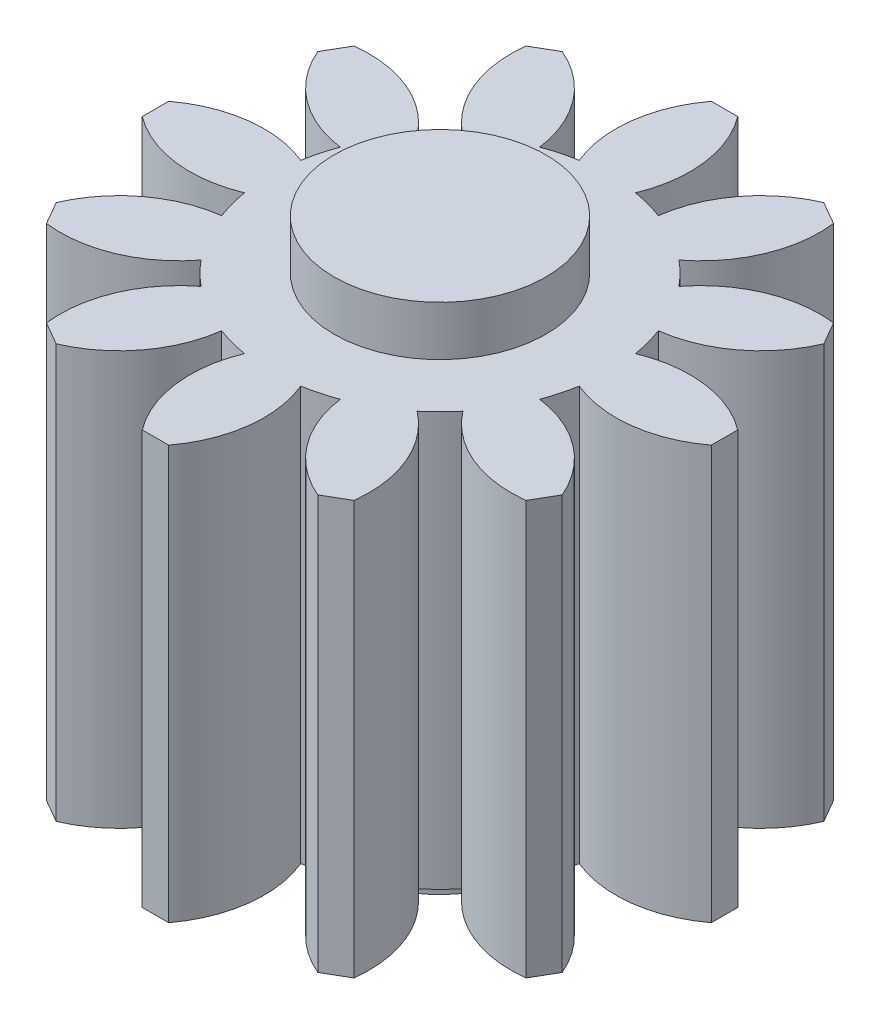
from build123d import *

# Parameters (mm, degrees)
BOSS_EXTRUDE2_DEPTH = 12.5
CIRPATTERN1_COUNT   = 12


with BuildPart() as part:
    # Sketch1 → Revolve1 (revolve)
    with BuildSketch(Plane(origin=(0, 0, 0), x_dir=(0, 0, -1), z_dir=(1, 0, 0)), mode=Mode.PRIVATE) as revolve1_sk:
        Polygon((0, 0), (3.2, 0), (3.2, 1.5), (5.13, 1.5), (5.13, 14), (3.2, 14), (3.2, 15.5), (0, 15.5), align=None)
    revolve(revolve1_sk.sketch.rotate(Axis((0, 15.5, 0), (0, -1, 0)), 180), axis=Axis((0, 15.5, 0), (0, -1, 0)))

    # Sketch2 → Boss-Extrude2 (add)
    with BuildSketch(Plane(origin=(0, 14, 0), x_dir=(1, 0, 0), z_dir=(0, 1, 0))):
        with BuildLine():
            Line((0.4, 8.6), (-0.4, 8.6))
            ThreePointArc((-0.4, 8.6), (-1.094743674, 6.889243261), (-0.85, 5.059090827))
            Line((-0.85, 5.059090827), (-0.85, 4.768997596))
            Line((-0.85, 4.768997596), (0.85, 4.768997596))
            Line((0.85, 4.768997596), (0.85, 5.059090827))
            ThreePointArc((0.85, 5.059090827), (1.094743674, 6.889243261), (0.4, 8.6))
        make_face()
    boss_extrude2 = extrude(amount=-BOSS_EXTRUDE2_DEPTH)

    # CirPattern1: Boss-Extrude2 ×12 about axis
    cirpattern1_axis = Axis((0, 0, 0), (0, 1, 0))
    for i in range(1, CIRPATTERN1_COUNT):
        add(boss_extrude2.rotate(cirpattern1_axis, i * 360 / CIRPATTERN1_COUNT))


solid = part.part
